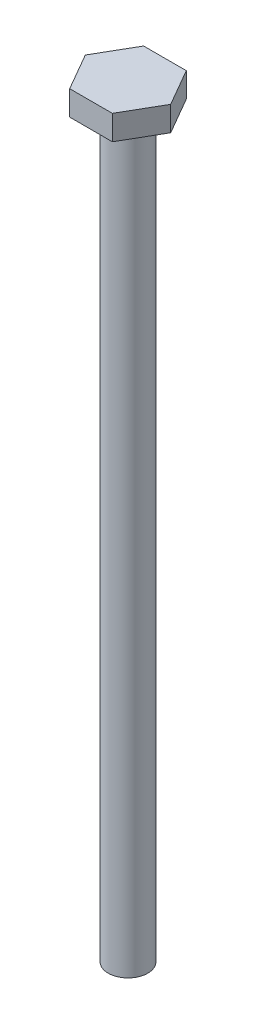
from build123d import *

# Parameters (mm, degrees)
BOSS_EXTRUDE1_DEPTH = 2.5
SKETCH2_R           = 2
BOSS_EXTRUDE2_DEPTH = 75


with BuildPart() as part:
    # Sketch1 → Boss-Extrude1 (new body)
    with BuildSketch(Plane(origin=(0, 0, 0), x_dir=(1, 0, 0), z_dir=(0, 1, 0))):
        Polygon((4.330127019, 0), (2.165063509, 3.75), (-2.165063509, 3.75), (-4.330127019, 0), (-2.165063509, -3.75), (2.165063509, -3.75), align=None)
    extrude(amount=BOSS_EXTRUDE1_DEPTH)

    # Sketch2 → Boss-Extrude2 (add)
    with BuildSketch(Plane.XZ):
        with Locations(Location((0, 0, 0), (0, 0, 270))):
            Circle(SKETCH2_R)
    extrude(amount=BOSS_EXTRUDE2_DEPTH)


solid = part.part
